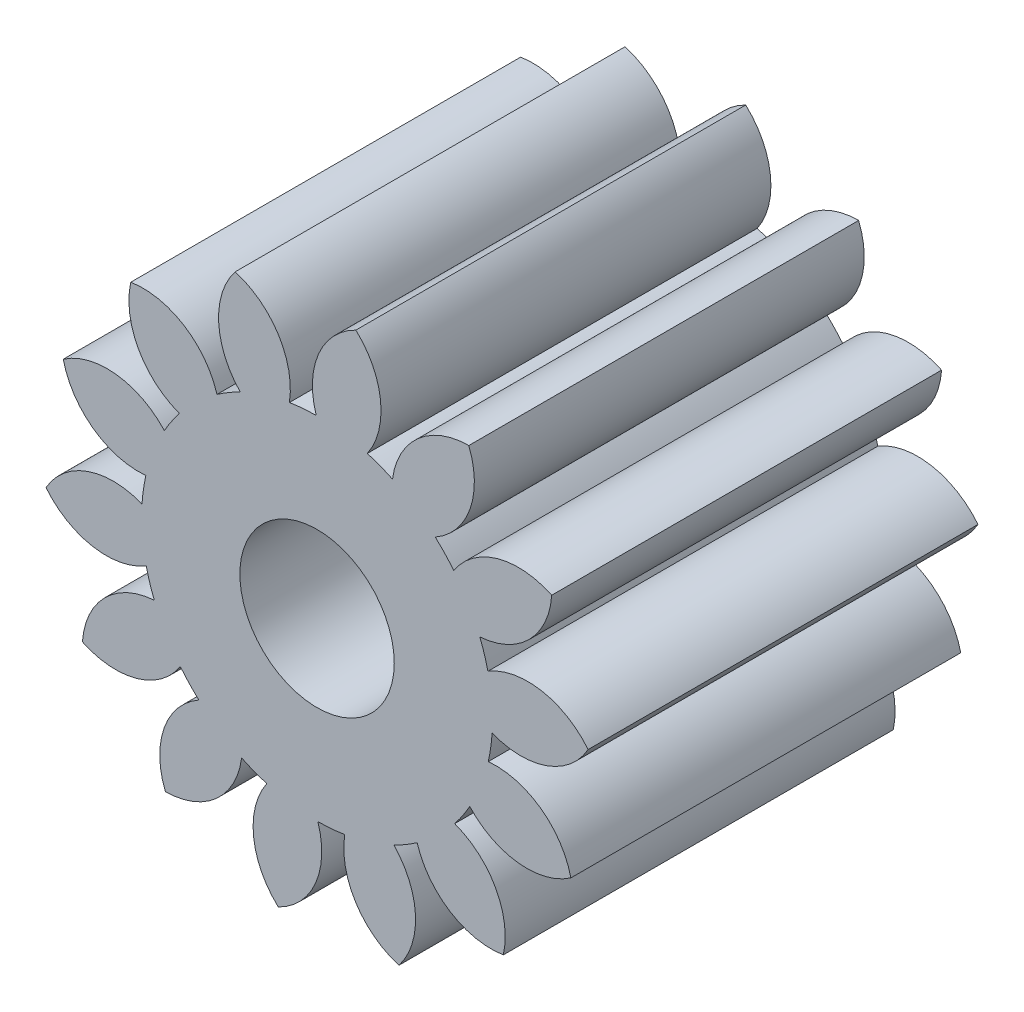
from build123d import *

# Parameters (mm, degrees)
CROQUIS1_R              = 3.5
CROQUIS1_R_2            = 0.99
SALIENTE_EXTRUIR1_DEPTH = 5
CORTAR_EXTRUIR1_START   = -5
CORTAR_EXTRUIR1_DEPTH   = 5
MATRIZC1_COUNT          = 14


with BuildPart() as part:
    # Croquis1 → Saliente-Extruir1 (new body)
    with BuildSketch(Plane.XY):
        Circle(CROQUIS1_R)
        Circle(CROQUIS1_R_2, mode=Mode.SUBTRACT)
    extrude(amount=SALIENTE_EXTRUIR1_DEPTH)

    # Croquis2 → Cortar-Extruir1 (cut)
    with BuildSketch(Plane.XY.offset(5).offset(CORTAR_EXTRUIR1_START)):
        with BuildLine():
            ThreePointArc((0.516991774, 3.461606492), (-0.284402129, 3.488425924), (-1.070868948, 3.332152412))
            ThreePointArc((-1.070868948, 3.332152412), (-0.501013204, 2.913608412), (-0.354709173, 2.221864398))
            ThreePointArc((-0.354709173, 2.221864398), (-0.18282994, 2.242559523), (-0.009868326, 2.249978359))
            ThreePointArc((-0.009868326, 2.249978359), (0.022456296, 2.956285494), (0.516991774, 3.461606492))
        make_face()
    cortar_extruir1 = extrude(amount=CORTAR_EXTRUIR1_DEPTH, mode=Mode.SUBTRACT)

    # MatrizC1: Cortar-Extruir1 ×14 about axis
    matrizc1_axis = Axis((0, 0, 0), (0, 0, 1))
    for i in range(1, MATRIZC1_COUNT):
        add(cortar_extruir1.rotate(matrizc1_axis, i * 360 / MATRIZC1_COUNT), mode=Mode.SUBTRACT)


solid = part.part
